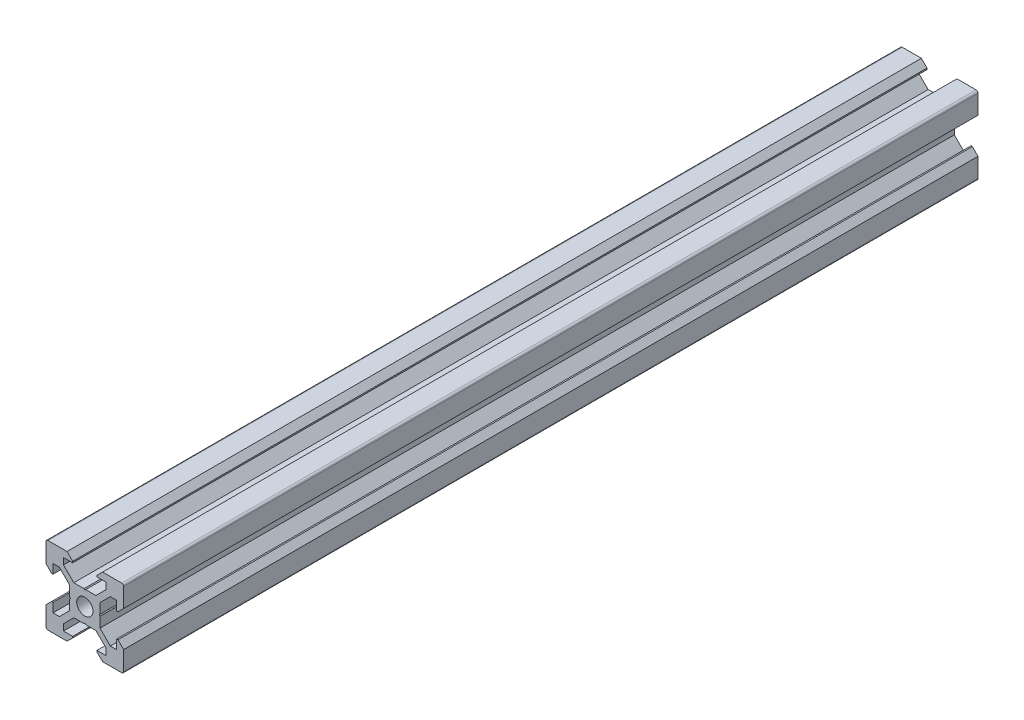
from build123d import *

# Parameters (mm, degrees)
SKETCH1_R           = 2.1
BOSS_EXTRUDE1_DEPTH = 110


with BuildPart() as part:
    # Sketch1 → Boss-Extrude1 (new, symmetric)
    with BuildSketch(Plane.XY):
        with BuildLine():
            Line((4.58, -10), (9.5, -10))
            ThreePointArc((9.5, -10), (9.853553391, -9.853553391), (10, -9.5))
            Line((10, -9.5), (10, -4.58))
            Line((10, -4.58), (8.545, -3.125))
            Line((8.545, -3.125), (8.2, -3.125))
            Line((8.2, -3.125), (8.2, -5.5))
            Line((8.2, -5.5), (6.560660172, -5.5))
            Line((6.560660172, -5.5), (3.9, -2.839339828))
            Line((3.9, -2.839339828), (3.9, -0.21))
            Line((3.9, -0.21), (3.69, 0))
            Line((3.69, 0), (3.9, 0.21))
            Line((3.9, 0.21), (3.9, 2.839339828))
            Line((3.9, 2.839339828), (6.560660172, 5.5))
            Line((6.560660172, 5.5), (8.2, 5.5))
            Line((8.2, 5.5), (8.2, 3.125))
            Line((8.2, 3.125), (8.545, 3.125))
            Line((8.545, 3.125), (10, 4.58))
            Line((10, 4.58), (10, 9.5))
            ThreePointArc((10, 9.5), (9.853553391, 9.853553391), (9.5, 10))
            Line((9.5, 10), (4.58, 10))
            Line((4.58, 10), (3.125, 8.545))
            Line((3.125, 8.545), (3.125, 8.2))
            Line((3.125, 8.2), (5.5, 8.2))
            Line((5.5, 8.2), (5.5, 6.560660172))
            Line((5.5, 6.560660172), (2.839339828, 3.9))
            Line((2.839339828, 3.9), (0.21, 3.9))
            Line((0.21, 3.9), (0, 3.69))
            Line((0, 3.69), (-0.21, 3.9))
            Line((-0.21, 3.9), (-2.839339828, 3.9))
            Line((-2.839339828, 3.9), (-5.5, 6.560660172))
            Line((-5.5, 6.560660172), (-5.5, 8.2))
            Line((-5.5, 8.2), (-3.125, 8.2))
            Line((-3.125, 8.2), (-3.125, 8.545))
            Line((-3.125, 8.545), (-4.58, 10))
            Line((-4.58, 10), (-9.5, 10))
            ThreePointArc((-9.5, 10), (-9.853553391, 9.853553391), (-10, 9.5))
            Line((-10, 9.5), (-10, 4.58))
            Line((-10, 4.58), (-8.545, 3.125))
            Line((-8.545, 3.125), (-8.2, 3.125))
            Line((-8.2, 3.125), (-8.2, 5.5))
            Line((-8.2, 5.5), (-6.560660172, 5.5))
            Line((-6.560660172, 5.5), (-3.9, 2.839339828))
            Line((-3.9, 2.839339828), (-3.9, 0.21))
            Line((-3.9, 0.21), (-3.69, 0))
            Line((-3.69, 0), (-3.9, -0.21))
            Line((-3.9, -0.21), (-3.9, -2.839339828))
            Line((-3.9, -2.839339828), (-6.560660172, -5.5))
            Line((-6.560660172, -5.5), (-8.2, -5.5))
            Line((-8.2, -5.5), (-8.2, -3.125))
            Line((-8.2, -3.125), (-8.545, -3.125))
            Line((-8.545, -3.125), (-10, -4.58))
            Line((-10, -4.58), (-10, -9.5))
            ThreePointArc((-10, -9.5), (-9.853553391, -9.853553391), (-9.5, -10))
            Line((-9.5, -10), (-4.58, -10))
            Line((-4.58, -10), (-3.125, -8.545))
            Line((-3.125, -8.545), (-3.125, -8.2))
            Line((-3.125, -8.2), (-5.5, -8.2))
            Line((-5.5, -8.2), (-5.5, -6.560660172))
            Line((-5.5, -6.560660172), (-2.839339828, -3.9))
            Line((-2.839339828, -3.9), (-0.21, -3.9))
            Line((-0.21, -3.9), (0, -3.69))
            Line((0, -3.69), (0.21, -3.9))
            Line((0.21, -3.9), (2.839339828, -3.9))
            Line((2.839339828, -3.9), (5.5, -6.560660172))
            Line((5.5, -6.560660172), (5.5, -8.2))
            Line((5.5, -8.2), (3.125, -8.2))
            Line((3.125, -8.2), (3.125, -8.545))
            Line((3.125, -8.545), (4.58, -10))
        make_face()
        Circle(SKETCH1_R, mode=Mode.SUBTRACT)
    extrude(amount=BOSS_EXTRUDE1_DEPTH, both=True)


solid = part.part
